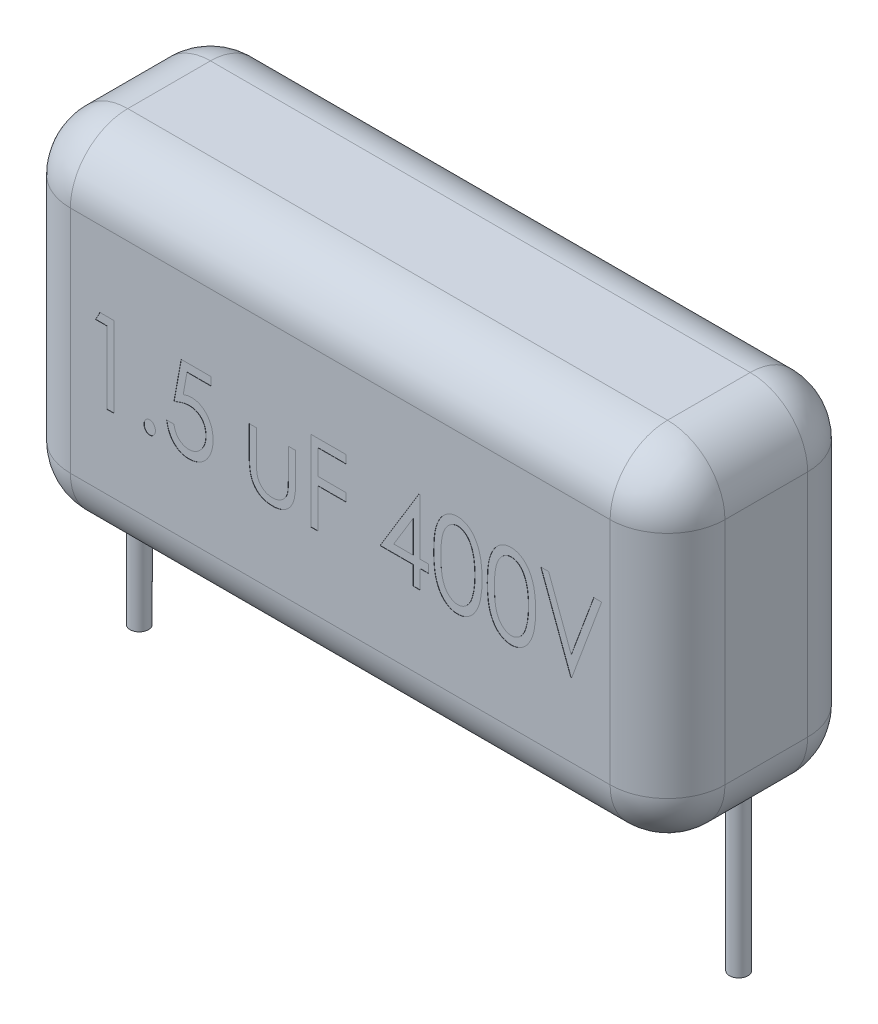
from build123d import *

# Parameters (mm, degrees)
BOSS_EXTRUDE1_DEPTH = 14.25
FILLET1_R           = 2.5
SKETCH2_R           = 0.4
BOSS_EXTRUDE2_DEPTH = 13.5
CUT_EXTRUDE1_DEPTH  = 0.01


with BuildPart() as part:
    # Sketch1 → Boss-Extrude1 (new, symmetric)
    with BuildSketch(Plane(origin=(0, 0, 0), x_dir=(0, 0, -1), z_dir=(1, 0, 0))):
        with BuildLine():
            Line((-1.8, 7.5), (1.8, 7.5))
            ThreePointArc((1.8, 7.5), (3.567766953, 6.767766953), (4.3, 5))
            Line((4.3, 5), (4.3, -5))
            ThreePointArc((4.3, -5), (3.567766953, -6.767766953), (1.8, -7.5))
            Line((1.8, -7.5), (-1.8, -7.5))
            ThreePointArc((-1.8, -7.5), (-3.567766953, -6.767766953), (-4.3, -5))
            Line((-4.3, -5), (-4.3, 5))
            ThreePointArc((-4.3, 5), (-3.567766953, 6.767766953), (-1.8, 7.5))
        make_face()
    extrude(amount=BOSS_EXTRUDE1_DEPTH, both=True)

    # Fillet1
    fillet1_edges = [part.edges().sort_by_distance(p)[0] for p in [
        (-14.25, 7.5, 0),
        (-14.25, 6.767766953, -3.567766953),
        (-14.25, 0, -4.3),
        (-14.25, -6.767766953, -3.567766953),
        (14.25, 6.767766953, -3.567766953),
        (14.25, 7.5, 0),
        (14.25, 6.767766953, 3.567766953),
        (14.25, 0, 4.3),
        (14.25, -6.767766953, 3.567766953),
        (14.25, -7.5, 0),
        (14.25, -6.767766953, -3.567766953),
        (-14.25, -7.5, 0),
        (14.25, 0, -4.3),
        (-14.25, -6.767766953, 3.567766953),
        (-14.25, 0, 4.3),
        (-14.25, 6.767766953, 3.567766953),
    ]]
    fillet(fillet1_edges, radius=FILLET1_R)

    # Sketch2 → Boss-Extrude2 (add)
    with BuildSketch(Plane(origin=(0, 0, 0), x_dir=(1, 0, 0), z_dir=(0, 1, 0))):
        with Locations(Location((13.05, 0, 0), (0, 0, 270))):
            Circle(SKETCH2_R)
        with Locations(Location((-13.05, 0, 0), (0, 0, 270))):
            Circle(SKETCH2_R)
    extrude(amount=-BOSS_EXTRUDE2_DEPTH)

    # Sketch4 → Cut-Extrude1 (cut)
    # profile 1 of 9: a face of its own
    with BuildSketch(Plane.XY.offset(4.3)):
        Polygon((-10.463761016, 1.706828106), (-9.843969349, 1.706828106), (-9.843969349, -1.793171894), (-10.158071914, -1.793171894), (-10.158071914, 1.347853747), (-10.651661657, 1.347853747), align=None)
    # profile 2 of 9: a face of its own
    with BuildSketch(Plane.XY.offset(4.3)):
        with BuildLine():
            add(Edge.make_bspline(
                [(-8.295892426, -1.254710355), (-8.279414886, -1.25586551), (-8.24688861, -1.258145757), (-8.199836892, -1.274207999), (-8.157153465, -1.301646569), (-8.119757992, -1.339021142), (-8.088370196, -1.383295335), (-8.065769069, -1.433548887), (-8.050915743, -1.488271279), (-8.049715004, -1.526644552), (-8.049097555, -1.546377022)],
                knots=[0, 0, 0, 0, 0.932051743, 1.839848197, 2.779380411, 3.780329255, 4.815317283, 5.833513928, 6.885940208, 8, 8, 8, 8], degree=3))
            add(Edge.make_bspline(
                [(-8.049097555, -1.546377022), (-8.049753958, -1.565635951), (-8.051045496, -1.603529748), (-8.065735246, -1.657825164), (-8.088574978, -1.708149084), (-8.119520701, -1.752950226), (-8.157155936, -1.790456979), (-8.19997759, -1.817654081), (-8.246739805, -1.834813569), (-8.279390612, -1.836959253), (-8.295892426, -1.838043688)],
                knots=[0, 0, 0, 0, 1.089197406, 2.143100788, 3.162726492, 4.210031689, 5.212385385, 6.153236251, 7.066640104, 8, 8, 8, 8], degree=3))
            add(Edge.make_bspline(
                [(-8.295892426, -1.838043688), (-8.312394241, -1.836959253), (-8.345045047, -1.834813569), (-8.391807262, -1.817654081), (-8.434628917, -1.790456979), (-8.472264152, -1.752950226), (-8.503209874, -1.708149084), (-8.526049606, -1.657825164), (-8.540739356, -1.603529748), (-8.542030894, -1.565635951), (-8.542687298, -1.546377022)],
                knots=[0, 0, 0, 0, 0.933359896, 1.846763749, 2.787614615, 3.789968311, 4.837273508, 5.856899212, 6.910802594, 8, 8, 8, 8], degree=3))
            add(Edge.make_bspline(
                [(-8.542687298, -1.546377022), (-8.542069849, -1.526644552), (-8.54086911, -1.488271279), (-8.526015784, -1.433548887), (-8.503414656, -1.383295335), (-8.47202686, -1.339021142), (-8.434631387, -1.301646569), (-8.39194796, -1.274207999), (-8.344896243, -1.258145757), (-8.312369967, -1.25586551), (-8.295892426, -1.254710355)],
                knots=[0, 0, 0, 0, 1.114059792, 2.166486072, 3.184682717, 4.219670745, 5.220619589, 6.160151803, 7.067948257, 8, 8, 8, 8], degree=3))
        make_face()
    # profile 3 of 9: a face of its own
    with BuildSketch(Plane.XY.offset(4.3)):
        with BuildLine():
            Line((-5.626020631, 1.706828106), (-5.626020631, 1.347853747))
            Line((-5.626020631, 1.347853747), (-6.671393228, 1.347853747))
            Line((-6.671393228, 1.347853747), (-6.837559093, 0.421671856))
            add(Edge.make_bspline(
                [(-6.837559093, 0.421671856), (-6.805698068, 0.432920113), (-6.744267404, 0.454607671), (-6.652866811, 0.477952108), (-6.566182359, 0.491838457), (-6.509946019, 0.494165835), (-6.482791465, 0.495289645)],
                knots=[0, 0, 0, 0, 1.113143318, 2.146231409, 3.104880253, 4, 4, 4, 4], degree=3))
            add(Edge.make_bspline(
                [(-6.482791465, 0.495289645), (-6.449074497, 0.494449051), (-6.382906933, 0.492799434), (-6.286269095, 0.476792947), (-6.194162306, 0.45135743), (-6.106420632, 0.416564981), (-6.023273009, 0.370836764), (-5.944756019, 0.315321836), (-5.870503304, 0.249656122), (-5.802567784, 0.173719831), (-5.739695374, 0.09138154), (-5.685300802, 0.001930053), (-5.639184203, -0.092682989), (-5.60070143, -0.192927334), (-5.5725641, -0.299318749), (-5.551393829, -0.411043647), (-5.538581471, -0.528518026), (-5.537055763, -0.60871152), (-5.536277042, -0.649642246)],
                knots=[0, 0, 0, 0, 0.973560614, 1.910555428, 2.821466426, 3.73059852, 4.631163213, 5.556699778, 6.503883695, 7.488691105, 8.49622651, 9.493389215, 10.5081404, 11.534042417, 12.590644417, 13.683294485, 14.817554483, 16, 16, 16, 16], degree=3))
            add(Edge.make_bspline(
                [(-5.536277042, -0.649642246), (-5.538103595, -0.706293395), (-5.541700802, -0.817861902), (-5.567916174, -0.981528926), (-5.612520546, -1.137894108), (-5.664031828, -1.261597685), (-5.712535577, -1.355557954), (-5.752682251, -1.421391206), (-5.795363036, -1.483512867), (-5.841787605, -1.540933206), (-5.890921889, -1.594381099), (-5.942982282, -1.643793068), (-5.998512139, -1.688855365), (-6.05743375, -1.729081923), (-6.118252665, -1.766207314), (-6.18253439, -1.796579146), (-6.248381162, -1.823551392), (-6.316831177, -1.845344831), (-6.387624145, -1.862175267), (-6.460776804, -1.87372237), (-6.536114823, -1.882159619), (-6.587234027, -1.882660871), (-6.613200119, -1.882915483)],
                knots=[0, 0, 0, 0, 1.854240742, 3.651732996, 5.409993055, 7.166221002, 8.028594238, 8.869695635, 9.688937347, 10.494306344, 11.284856283, 12.064219686, 12.842117024, 13.623131146, 14.398616627, 15.171985563, 15.947735206, 16.72687324, 17.521153864, 18.327430933, 19.15041553, 20, 20, 20, 20], degree=3))
            add(Edge.make_bspline(
                [(-6.613200119, -1.882915483), (-6.643873949, -1.882219632), (-6.704353154, -1.880847629), (-6.792986263, -1.866603644), (-6.878523073, -1.846138369), (-6.959991438, -1.815630342), (-7.037975631, -1.776907457), (-7.111475938, -1.728658534), (-7.182308201, -1.673058757), (-7.248395382, -1.608770374), (-7.309029035, -1.537361953), (-7.3639322, -1.460685833), (-7.412606071, -1.378892016), (-7.454529172, -1.292077962), (-7.489810829, -1.200107853), (-7.518310293, -1.103234532), (-7.541055997, -1.001349278), (-7.550635164, -0.931345105), (-7.555507811, -0.895735996)],
                knots=[0, 0, 0, 0, 0.980012484, 1.932278219, 2.86391096, 3.788442921, 4.707522156, 5.642386417, 6.594769441, 7.583067065, 8.584946701, 9.586603339, 10.595260768, 11.624716315, 12.665609409, 13.74146141, 14.851146399, 16, 16, 16, 16], degree=3))
            Line((-7.555507811, -0.895735996), (-7.241405247, -0.895735996))
            add(Edge.make_bspline(
                [(-7.241405247, -0.895735996), (-7.235053315, -0.929082926), (-7.222886944, -0.992955004), (-7.194849089, -1.082609169), (-7.162689236, -1.163378368), (-7.122110301, -1.234272346), (-7.075137093, -1.297074639), (-7.021172151, -1.352779483), (-6.960867608, -1.40298274), (-6.893458638, -1.445269299), (-6.822267752, -1.480501745), (-6.747586778, -1.504831034), (-6.671650324, -1.521351338), (-6.620063682, -1.52307785), (-6.59426983, -1.523941124)],
                knots=[0, 0, 0, 0, 1.237908536, 2.371066588, 3.422813746, 4.404583581, 5.342816831, 6.277826636, 7.229035638, 8.199176782, 9.175745742, 10.119776575, 11.059868941, 12, 12, 12, 12], degree=3))
            add(Edge.make_bspline(
                [(-6.59426983, -1.523941124), (-6.569209693, -1.523119657), (-6.519738232, -1.521497991), (-6.446915263, -1.508957345), (-6.376496445, -1.489915313), (-6.309590641, -1.460781905), (-6.244227653, -1.426411916), (-6.183566402, -1.380984873), (-6.123969344, -1.329949638), (-6.068729184, -1.270597091), (-6.017680338, -1.205735174), (-5.972528112, -1.136190146), (-5.934717521, -1.062341686), (-5.903598828, -0.984694409), (-5.879805749, -0.903185323), (-5.863237061, -0.817735346), (-5.852238347, -0.728453039), (-5.85100738, -0.667437753), (-5.850379606, -0.636320932)],
                knots=[0, 0, 0, 0, 0.933673813, 1.843174603, 2.747905908, 3.645942738, 4.55819341, 5.494019063, 6.463585747, 7.480531844, 8.510567353, 9.537614091, 10.566285436, 11.598455736, 12.651591861, 13.726309059, 14.840453956, 16, 16, 16, 16], degree=3))
            add(Edge.make_bspline(
                [(-5.850379606, -0.636320932), (-5.850756201, -0.608240269), (-5.851493049, -0.553297486), (-5.861994823, -0.47318132), (-5.876975466, -0.397060004), (-5.898892152, -0.324975832), (-5.927053451, -0.257016571), (-5.960559881, -0.192429597), (-6.00165639, -0.132926167), (-6.047932529, -0.077584357), (-6.098731347, -0.026809563), (-6.155033911, 0.016620897), (-6.215469853, 0.053194569), (-6.279304794, 0.084868881), (-6.348458869, 0.107267314), (-6.421085454, 0.124495168), (-6.497955224, 0.134205521), (-6.550540884, 0.135601251), (-6.577442907, 0.136315286)],
                knots=[0, 0, 0, 0, 1.127360635, 2.20580017, 3.240687026, 4.241666562, 5.226843905, 6.192863443, 7.15906549, 8.125632452, 9.088360914, 10.038692719, 10.974299228, 11.923377817, 12.894313054, 13.887334147, 14.919192329, 16, 16, 16, 16], degree=3))
            add(Edge.make_bspline(
                [(-6.577442907, 0.136315286), (-6.600835506, 0.135733862), (-6.649162708, 0.134532689), (-6.723191231, 0.12571006), (-6.800876602, 0.111459639), (-6.882083166, 0.091742928), (-6.966999203, 0.06638196), (-7.055535582, 0.035181149), (-7.147855237, -0.000912507), (-7.209740915, -0.028868151), (-7.241405247, -0.043171894)],
                knots=[0, 0, 0, 0, 0.810269167, 1.673950008, 2.579134618, 3.545268136, 4.567349434, 5.647883586, 6.7965197, 8, 8, 8, 8], degree=3))
            Line((-7.241405247, -0.043171894), (-6.927302683, 1.706828106))
            Line((-6.927302683, 1.706828106), (-5.626020631, 1.706828106))
        make_face()
    # profile 4 of 9: a face of its own
    with BuildSketch(Plane.XY.offset(4.3)):
        with BuildLine():
            Line((-3.965764221, 0.764520414), (-3.651661657, 0.764520414))
            Line((-3.651661657, 0.764520414), (-3.651661657, -0.421777663))
            add(Edge.make_bspline(
                [(-3.651661657, -0.421777663), (-3.651570938, -0.456602396), (-3.651397397, -0.523220478), (-3.648889213, -0.619031113), (-3.646784985, -0.706499898), (-3.641447598, -0.7854645), (-3.636167612, -0.85610956), (-3.629282739, -0.918094243), (-3.621178969, -0.971982047), (-3.613742693, -1.004677825), (-3.610295471, -1.019834554)],
                knots=[0, 0, 0, 0, 1.391532709, 2.661936892, 3.829901352, 4.887223925, 5.824101155, 6.660496541, 7.379048576, 8, 8, 8, 8], degree=3))
            add(Edge.make_bspline(
                [(-3.610295471, -1.019834554), (-3.598658506, -1.057243052), (-3.5759741, -1.130164942), (-3.521995395, -1.229712293), (-3.45489031, -1.317218351), (-3.373718885, -1.391309611), (-3.280902861, -1.449947177), (-3.179160934, -1.493778374), (-3.068179496, -1.519378684), (-2.99133721, -1.522394825), (-2.951942106, -1.523941124)],
                knots=[0, 0, 0, 0, 1.047486636, 2.041907865, 3.014989621, 3.990003216, 4.969629675, 5.943033671, 6.945445186, 8, 8, 8, 8], degree=3))
            add(Edge.make_bspline(
                [(-2.951942106, -1.523941124), (-2.912783236, -1.522359898), (-2.836688159, -1.519287197), (-2.727217178, -1.494451123), (-2.62725941, -1.452340834), (-2.537502024, -1.394550608), (-2.45840189, -1.323630578), (-2.393134313, -1.240360987), (-2.338785334, -1.147841781), (-2.315791972, -1.079705359), (-2.304105567, -1.045074938)],
                knots=[0, 0, 0, 0, 1.083224142, 2.104964324, 3.087867758, 4.071345921, 5.047068855, 6.014022567, 6.990624521, 8, 8, 8, 8], degree=3))
            add(Edge.make_bspline(
                [(-2.304105567, -1.045074938), (-2.300337273, -1.031108012), (-2.29200128, -1.000211229), (-2.284585453, -0.94771341), (-2.276629236, -0.885366479), (-2.270379368, -0.812394412), (-2.266766836, -0.729119981), (-2.262982788, -0.635647896), (-2.261019507, -0.532095726), (-2.26076763, -0.459638853), (-2.260636016, -0.421777663)],
                knots=[0, 0, 0, 0, 0.553958893, 1.225434092, 2.028671365, 2.963679295, 4.030914419, 5.223034872, 6.548940879, 8, 8, 8, 8], degree=3))
            Line((-2.260636016, -0.421777663), (-2.260636016, 0.764520414))
            Line((-2.260636016, 0.764520414), (-1.946533452, 0.764520414))
            Line((-1.946533452, 0.764520414), (-1.946533452, -0.480671894))
            add(Edge.make_bspline(
                [(-1.946533452, -0.480671894), (-1.946636183, -0.52298287), (-1.946835502, -0.605074988), (-1.953113642, -0.724275163), (-1.960597461, -0.835476253), (-1.973823635, -0.93851457), (-1.988630073, -1.033388769), (-2.007344287, -1.120394818), (-2.03067294, -1.198922367), (-2.064407342, -1.29221881), (-2.116839801, -1.397380714), (-2.194313795, -1.509764824), (-2.286000041, -1.608065489), (-2.373720321, -1.677218558), (-2.450664549, -1.72412803), (-2.511967211, -1.75499103), (-2.577194752, -1.780108482), (-2.645575202, -1.801268524), (-2.717708039, -1.818106569), (-2.793408517, -1.829814385), (-2.872571524, -1.837081734), (-2.926451696, -1.837717891), (-2.954045471, -1.838043688)],
                knots=[0, 0, 0, 0, 1.312098829, 2.54574533, 3.701569955, 4.767896179, 5.766537578, 6.679358675, 7.525722669, 8.305423759, 9.754479426, 11.155959474, 12.525277459, 13.908701379, 14.604880684, 15.31806066, 16.034181596, 16.770167898, 17.536786682, 18.329287869, 19.144374379, 20, 20, 20, 20], degree=3))
            add(Edge.make_bspline(
                [(-2.954045471, -1.838043688), (-2.981637916, -1.837704794), (-3.035748331, -1.837040201), (-3.114930795, -1.82992945), (-3.190606076, -1.818031185), (-3.262721913, -1.801175847), (-3.331575284, -1.780085267), (-3.397373078, -1.755179646), (-3.458941293, -1.723921774), (-3.536576313, -1.677428602), (-3.624997837, -1.607980855), (-3.717576407, -1.509196139), (-3.794559789, -1.394985708), (-3.847947004, -1.289069291), (-3.881697212, -1.194492606), (-3.90514878, -1.114347062), (-3.923449254, -1.025390479), (-3.938686165, -0.928023409), (-3.95156215, -0.822599442), (-3.959258543, -0.708387503), (-3.96545458, -0.585907673), (-3.965658785, -0.501247374), (-3.965764221, -0.457534874)],
                knots=[0, 0, 0, 0, 0.844445595, 1.656007694, 2.431087477, 3.187689243, 3.920896429, 4.634327057, 5.338188272, 6.031389025, 7.402366307, 8.763903704, 10.158861678, 11.604980077, 12.381214554, 13.230253831, 14.159118366, 15.158838041, 16.246741172, 17.408865503, 18.662124194, 20, 20, 20, 20], degree=3))
            Line((-3.965764221, -0.457534874), (-3.965764221, 0.764520414))
        make_face()
    # profile 5 of 9: a face of its own
    with BuildSketch(Plane.XY.offset(4.3)):
        Polygon((-1.273456529, 1.706828106), (0.252184497, 1.706828106), (0.252184497, 1.347853747), (-0.959353965, 1.347853747), (-0.959353965, 0.27093067), (0.252184497, 0.27093067), (0.252184497, -0.088043688), (-0.959353965, -0.088043688), (-0.959353965, -1.793171894), (-1.273456529, -1.793171894), align=None)
    # profile 6 of 9: a face of its own
    with BuildSketch(Plane.XY.offset(4.3)):
        Polygon((3.419151644, 1.796571696), (3.482953727, 1.796571696), (3.482953727, -0.626505227), (3.841928086, -0.626505227), (3.841928086, -0.985479586), (3.482953727, -0.985479586), (3.482953727, -1.793171894), (3.168851163, -1.793171894), (3.168851163, -0.985479586), (1.732953727, -0.985479586), align=None)
        Polygon((3.168851163, -0.626505227), (3.168851163, 0.755405831), (2.33171174, -0.626505227), align=None, mode=Mode.SUBTRACT)
    # profile 7 of 9: a face of its own
    with BuildSketch(Plane.XY.offset(4.3)):
        with BuildLine():
            add(Edge.make_bspline(
                [(4.066287061, -0.044574137), (4.066636894, 0.011523982), (4.067316388, 0.120485571), (4.074103369, 0.279199571), (4.083062596, 0.42824415), (4.098241454, 0.567305544), (4.115976648, 0.696513656), (4.138336871, 0.81586775), (4.164649774, 0.92551949), (4.19587949, 1.025787191), (4.230317755, 1.118575452), (4.268856463, 1.204586519), (4.310650438, 1.284884645), (4.354129604, 1.36038334), (4.403083713, 1.428884522), (4.453894944, 1.492547581), (4.509294852, 1.549486799), (4.567020588, 1.60155508), (4.62830616, 1.646757736), (4.69069755, 1.687285034), (4.755330354, 1.720907393), (4.821775117, 1.748398784), (4.889719981, 1.770283664), (4.959651887, 1.785731118), (5.031238434, 1.795124392), (5.079613463, 1.796087319), (5.103947317, 1.796571696)],
                knots=[0, 0, 0, 0, 1.712737898, 3.326718361, 4.849934128, 6.270757035, 7.596796976, 8.831195979, 9.976938934, 11.037759367, 12.035809522, 12.997271036, 13.913248545, 14.799301666, 15.654562441, 16.48149021, 17.283916513, 18.077408965, 18.852363637, 19.606538973, 20.347018853, 21.073229694, 21.799896157, 22.523578351, 23.257322845, 24, 24, 24, 24], degree=3))
            add(Edge.make_bspline(
                [(5.103947317, 1.796571696), (5.128750215, 1.796101814), (5.177827968, 1.795172053), (5.250550972, 1.785633641), (5.321477131, 1.770431361), (5.390473916, 1.748216921), (5.45803599, 1.7211486), (5.523545868, 1.687010114), (5.587486818, 1.647139107), (5.648997851, 1.600471785), (5.709141526, 1.548871739), (5.764936266, 1.489690737), (5.817426109, 1.424535047), (5.868695911, 1.35471635), (5.91416289, 1.277011924), (5.958152076, 1.19427611), (5.997714296, 1.104767424), (6.03530242, 1.009374999), (6.068243098, 0.90632509), (6.096857101, 0.795344603), (6.121213437, 0.675975309), (6.14155275, 0.54828153), (6.156943012, 0.411886246), (6.166722842, 0.267062182), (6.174407417, 0.113960278), (6.174971804, 0.009189268), (6.17526142, -0.044574137)],
                knots=[0, 0, 0, 0, 0.752180744, 1.488347903, 2.221332102, 2.950188717, 3.684954335, 4.427073921, 5.188489928, 5.968499684, 6.767646011, 7.590201753, 8.43188258, 9.305659254, 10.215299127, 11.160505459, 12.147606989, 13.182625504, 14.270232933, 15.427717507, 16.658470434, 17.96531266, 19.349783444, 20.821468742, 22.368931779, 24, 24, 24, 24], degree=3))
            add(Edge.make_bspline(
                [(6.17526142, -0.044574137), (6.174862661, -0.098098514), (6.174085746, -0.202381744), (6.167911311, -0.354864226), (6.156715832, -0.498904863), (6.141411155, -0.634562338), (6.121971933, -0.761619624), (6.09804718, -0.880447164), (6.07070883, -0.991204042), (6.037132658, -1.093431689), (6.000747155, -1.188497268), (5.960701097, -1.277228704), (5.917095418, -1.359931973), (5.871127637, -1.437358621), (5.821266421, -1.50842793), (5.767698932, -1.573258363), (5.711014358, -1.632128206), (5.651355222, -1.685091626), (5.588676173, -1.730951252), (5.525106643, -1.772391666), (5.458659991, -1.805648751), (5.391185865, -1.834227197), (5.321648752, -1.855943987), (5.250503758, -1.871076423), (5.177885922, -1.881743982), (5.128759466, -1.882522354), (5.103947317, -1.882915483)],
                knots=[0, 0, 0, 0, 1.625791635, 3.16758111, 4.634362493, 6.013326105, 7.313513755, 8.537269154, 9.694283847, 10.776350794, 11.803341178, 12.785072982, 13.731335007, 14.641990848, 15.518412538, 16.365536825, 17.193923029, 17.998641004, 18.785212613, 19.551271023, 20.300534794, 21.03882223, 21.775264372, 22.509067235, 23.246979152, 24, 24, 24, 24], degree=3))
            add(Edge.make_bspline(
                [(5.103947317, -1.882915483), (5.079613891, -1.882429185), (5.031239711, -1.881462436), (4.959646877, -1.872097424), (4.890025139, -1.856607886), (4.822346574, -1.835270834), (4.755982323, -1.809023041), (4.692217254, -1.774657895), (4.629764885, -1.735507107), (4.569158358, -1.69065644), (4.511836976, -1.639132937), (4.45675267, -1.58235837), (4.405579834, -1.518709806), (4.35750166, -1.449495676), (4.312239995, -1.374712506), (4.270889541, -1.293836775), (4.233402178, -1.206710088), (4.197925026, -1.113579869), (4.165854845, -1.012680189), (4.140002804, -0.902108315), (4.116481355, -0.782474814), (4.099008715, -0.65316601), (4.083965477, -0.51456275), (4.073839269, -0.366277939), (4.067397965, -0.208460748), (4.066664142, -0.100203237), (4.066287061, -0.044574137)],
                knots=[0, 0, 0, 0, 0.743613562, 1.478283201, 2.202877853, 2.921494687, 3.645913188, 4.380999621, 5.13229658, 5.898229586, 6.68263495, 7.486072995, 8.314043399, 9.176234408, 10.060926981, 10.984410639, 11.950736434, 12.959248835, 14.030356592, 15.184487265, 16.428798955, 17.756510839, 19.172020399, 20.690514867, 22.299391159, 24, 24, 24, 24], degree=3))
        make_face()
        with BuildLine():
            add(Edge.make_bspline(
                [(4.380389625, -0.043171894), (4.380640014, -0.089916888), (4.381125877, -0.180622352), (4.385397411, -0.31246952), (4.392163543, -0.435460227), (4.402037629, -0.549552587), (4.414168265, -0.654901233), (4.43058819, -0.751381789), (4.448271493, -0.839292914), (4.469706851, -0.918780737), (4.493357365, -0.991772458), (4.521229651, -1.059041682), (4.550147549, -1.122408278), (4.582848266, -1.18061859), (4.616959709, -1.235255776), (4.654858276, -1.284684567), (4.695015348, -1.330086219), (4.751043048, -1.383133667), (4.82448328, -1.43891101), (4.918354984, -1.487472023), (5.015128194, -1.518046517), (5.08106749, -1.521987176), (5.113763022, -1.523941124)],
                knots=[0, 0, 0, 0, 1.533539051, 2.975727605, 4.327350958, 5.574085108, 6.732432991, 7.805117054, 8.784043935, 9.673055441, 10.504702577, 11.299185573, 12.060685142, 12.788272239, 13.488058854, 14.171998547, 14.82910999, 15.474486357, 16.70125626, 17.839742354, 18.928851556, 20, 20, 20, 20], degree=3))
            add(Edge.make_bspline(
                [(5.113763022, -1.523941124), (5.146720594, -1.522351349), (5.212749738, -1.5191663), (5.308794261, -1.4877992), (5.402167364, -1.441607149), (5.474001135, -1.386204533), (5.52899287, -1.334291809), (5.568676867, -1.289515469), (5.605627229, -1.240110409), (5.639120775, -1.185532206), (5.671029045, -1.126935068), (5.700315681, -1.063560607), (5.726213451, -0.994974456), (5.741259031, -0.947460552), (5.748979369, -0.923079746)],
                knots=[0, 0, 0, 0, 1.260031109, 2.524420714, 3.838978787, 5.240585022, 5.982240997, 6.737630522, 7.53163645, 8.34478141, 9.190888301, 10.089069349, 11.019444295, 12, 12, 12, 12], degree=3))
            add(Edge.make_bspline(
                [(5.748979369, -0.923079746), (5.758232323, -0.891859933), (5.777025666, -0.828450498), (5.798719652, -0.729664632), (5.818893192, -0.626941304), (5.833645461, -0.519185161), (5.846873045, -0.407054007), (5.854505247, -0.289807759), (5.860804649, -0.168039585), (5.861039499, -0.08524849), (5.861158856, -0.043171894)],
                knots=[0, 0, 0, 0, 0.877554436, 1.782369142, 2.725190345, 3.699077286, 4.713512245, 5.768404222, 6.865844737, 8, 8, 8, 8], degree=3))
            add(Edge.make_bspline(
                [(5.861158856, -0.043171894), (5.860972436, -0.00109837), (5.860607746, 0.081209539), (5.855351039, 0.201597194), (5.848044337, 0.316210687), (5.836642274, 0.424909673), (5.822793973, 0.527821873), (5.806116292, 0.624961559), (5.785979365, 0.716285267), (5.761782086, 0.801685906), (5.736401944, 0.881752152), (5.707199957, 0.955705644), (5.676594691, 1.024392808), (5.64380541, 1.087898854), (5.607906622, 1.145374656), (5.570133426, 1.197756332), (5.529376502, 1.244103325), (5.473253722, 1.29733128), (5.3998199, 1.352259871), (5.307627273, 1.40204757), (5.21134902, 1.431536269), (5.14620325, 1.435582474), (5.113763022, 1.437597337)],
                knots=[0, 0, 0, 0, 1.381209292, 2.702042534, 3.955571768, 5.151192574, 6.289502008, 7.36425752, 8.386253595, 9.358021076, 10.277650789, 11.142548216, 11.966806051, 12.745861644, 13.486804304, 14.189703291, 14.86387237, 15.509720055, 16.726644761, 17.862702138, 18.935703305, 20, 20, 20, 20], degree=3))
            add(Edge.make_bspline(
                [(5.113763022, 1.437597337), (5.080858804, 1.435579285), (5.014801981, 1.431527948), (4.917332027, 1.402186081), (4.824252719, 1.35253027), (4.751120382, 1.297183867), (4.694833548, 1.245111714), (4.654823773, 1.199935944), (4.617747089, 1.150077503), (4.583488062, 1.095716329), (4.55092911, 1.037431288), (4.521693109, 0.974285993), (4.49517132, 0.906509204), (4.470049447, 0.834034047), (4.449316868, 0.75421728), (4.430175167, 0.666848546), (4.415045136, 0.570114565), (4.402882056, 0.464584402), (4.391978409, 0.350320977), (4.385422777, 0.227057167), (4.381115302, 0.094980614), (4.380636393, 0.00380716), (4.380389625, -0.043171894)],
                knots=[0, 0, 0, 0, 1.078543429, 2.165228563, 3.306998572, 4.522771429, 5.16274981, 5.819718716, 6.498896924, 7.198531744, 7.925961016, 8.687295404, 9.478752755, 10.312654144, 11.20147281, 12.181777119, 13.24542559, 14.411133613, 15.665913912, 17.009590841, 18.45912833, 20, 20, 20, 20], degree=3))
        make_face(mode=Mode.SUBTRACT)
    # profile 8 of 9: a face of its own
    with BuildSketch(Plane.XY.offset(4.3)):
        with BuildLine():
            add(Edge.make_bspline(
                [(6.399620394, -0.044574137), (6.399970227, 0.011523982), (6.400649721, 0.120485571), (6.407436703, 0.279199571), (6.416395929, 0.42824415), (6.431574787, 0.567305544), (6.449309981, 0.696513656), (6.471670204, 0.81586775), (6.497983107, 0.92551949), (6.529212823, 1.025787191), (6.563651089, 1.118575452), (6.602189797, 1.204586519), (6.643983771, 1.284884645), (6.687462937, 1.36038334), (6.736417046, 1.428884522), (6.787228278, 1.492547581), (6.842628185, 1.549486799), (6.900353921, 1.60155508), (6.961639493, 1.646757736), (7.024030883, 1.687285034), (7.088663687, 1.720907393), (7.155108451, 1.748398784), (7.223053314, 1.770283664), (7.292985221, 1.785731118), (7.364571767, 1.795124392), (7.412946796, 1.796087319), (7.437280651, 1.796571696)],
                knots=[0, 0, 0, 0, 1.712737898, 3.326718361, 4.849934128, 6.270757035, 7.596796976, 8.831195979, 9.976938934, 11.037759367, 12.035809522, 12.997271036, 13.913248545, 14.799301666, 15.654562441, 16.48149021, 17.283916513, 18.077408965, 18.852363637, 19.606538973, 20.347018853, 21.073229694, 21.799896157, 22.523578351, 23.257322845, 24, 24, 24, 24], degree=3))
            add(Edge.make_bspline(
                [(7.437280651, 1.796571696), (7.462083548, 1.796101814), (7.511161301, 1.795172053), (7.583884306, 1.785633641), (7.654810464, 1.770431361), (7.723807249, 1.748216921), (7.791369323, 1.7211486), (7.856879201, 1.687010114), (7.920820151, 1.647139107), (7.982331184, 1.600471785), (8.042474859, 1.548871739), (8.0982696, 1.489690737), (8.150759442, 1.424535047), (8.202029244, 1.35471635), (8.247496223, 1.277011924), (8.291485409, 1.19427611), (8.331047629, 1.104767424), (8.368635753, 1.009374999), (8.401576431, 0.90632509), (8.430190435, 0.795344603), (8.45454677, 0.675975309), (8.474886083, 0.54828153), (8.490276345, 0.411886246), (8.500056175, 0.267062182), (8.507740751, 0.113960278), (8.508305137, 0.009189268), (8.508594753, -0.044574137)],
                knots=[0, 0, 0, 0, 0.752180744, 1.488347903, 2.221332102, 2.950188717, 3.684954335, 4.427073921, 5.188489928, 5.968499684, 6.767646011, 7.590201753, 8.43188258, 9.305659254, 10.215299127, 11.160505459, 12.147606989, 13.182625504, 14.270232933, 15.427717507, 16.658470434, 17.96531266, 19.349783444, 20.821468742, 22.368931779, 24, 24, 24, 24], degree=3))
            add(Edge.make_bspline(
                [(8.508594753, -0.044574137), (8.508195994, -0.098098514), (8.50741908, -0.202381744), (8.501244644, -0.354864226), (8.490049165, -0.498904863), (8.474744489, -0.634562338), (8.455305267, -0.761619624), (8.431380513, -0.880447164), (8.404042164, -0.991204042), (8.370465991, -1.093431689), (8.334080488, -1.188497268), (8.29403443, -1.277228704), (8.250428751, -1.359931973), (8.20446097, -1.437358621), (8.154599754, -1.50842793), (8.101032266, -1.573258363), (8.044347691, -1.632128206), (7.984688555, -1.685091626), (7.922009507, -1.730951252), (7.858439976, -1.772391666), (7.791993324, -1.805648751), (7.724519198, -1.834227197), (7.654982085, -1.855943987), (7.583837091, -1.871076423), (7.511219256, -1.881743982), (7.462092799, -1.882522354), (7.437280651, -1.882915483)],
                knots=[0, 0, 0, 0, 1.625791635, 3.16758111, 4.634362493, 6.013326105, 7.313513755, 8.537269154, 9.694283847, 10.776350794, 11.803341178, 12.785072982, 13.731335007, 14.641990848, 15.518412538, 16.365536825, 17.193923029, 17.998641004, 18.785212613, 19.551271023, 20.300534794, 21.03882223, 21.775264372, 22.509067235, 23.246979152, 24, 24, 24, 24], degree=3))
            add(Edge.make_bspline(
                [(7.437280651, -1.882915483), (7.412947224, -1.882429185), (7.364573045, -1.881462436), (7.29298021, -1.872097424), (7.223358473, -1.856607886), (7.155679907, -1.835270834), (7.089315656, -1.809023041), (7.025550587, -1.774657895), (6.963098218, -1.735507107), (6.902491692, -1.69065644), (6.84517031, -1.639132937), (6.790086004, -1.58235837), (6.738913167, -1.518709806), (6.690834993, -1.449495676), (6.645573329, -1.374712506), (6.604222875, -1.293836775), (6.566735511, -1.206710088), (6.531258359, -1.113579869), (6.499188178, -1.012680189), (6.473336137, -0.902108315), (6.449814689, -0.782474814), (6.432342048, -0.65316601), (6.41729881, -0.51456275), (6.407172603, -0.366277939), (6.400731298, -0.208460748), (6.399997475, -0.100203237), (6.399620394, -0.044574137)],
                knots=[0, 0, 0, 0, 0.743613562, 1.478283201, 2.202877853, 2.921494687, 3.645913188, 4.380999621, 5.13229658, 5.898229586, 6.68263495, 7.486072995, 8.314043399, 9.176234408, 10.060926981, 10.984410639, 11.950736434, 12.959248835, 14.030356592, 15.184487265, 16.428798955, 17.756510839, 19.172020399, 20.690514867, 22.299391159, 24, 24, 24, 24], degree=3))
        make_face()
        with BuildLine():
            add(Edge.make_bspline(
                [(6.713722958, -0.043171894), (6.713973347, -0.089916888), (6.71445921, -0.180622352), (6.718730745, -0.31246952), (6.725496876, -0.435460227), (6.735370962, -0.549552587), (6.747501598, -0.654901233), (6.763921524, -0.751381789), (6.781604826, -0.839292914), (6.803040185, -0.918780737), (6.826690698, -0.991772458), (6.854562984, -1.059041682), (6.883480882, -1.122408278), (6.916181599, -1.18061859), (6.950293042, -1.235255776), (6.988191609, -1.284684567), (7.028348682, -1.330086219), (7.084376382, -1.383133667), (7.157816613, -1.43891101), (7.251688318, -1.487472023), (7.348461527, -1.518046517), (7.414400823, -1.521987176), (7.447096356, -1.523941124)],
                knots=[0, 0, 0, 0, 1.533539051, 2.975727605, 4.327350958, 5.574085108, 6.732432991, 7.805117054, 8.784043935, 9.673055441, 10.504702577, 11.299185573, 12.060685142, 12.788272239, 13.488058854, 14.171998547, 14.82910999, 15.474486357, 16.70125626, 17.839742354, 18.928851556, 20, 20, 20, 20], degree=3))
            add(Edge.make_bspline(
                [(7.447096356, -1.523941124), (7.480053927, -1.522351349), (7.546083071, -1.5191663), (7.642127594, -1.4877992), (7.735500697, -1.441607149), (7.807334469, -1.386204533), (7.862326203, -1.334291809), (7.9020102, -1.289515469), (7.938960563, -1.240110409), (7.972454109, -1.185532206), (8.004362378, -1.126935068), (8.033649014, -1.063560607), (8.059546784, -0.994974456), (8.074592364, -0.947460552), (8.082312702, -0.923079746)],
                knots=[0, 0, 0, 0, 1.260031109, 2.524420714, 3.838978787, 5.240585022, 5.982240997, 6.737630522, 7.53163645, 8.34478141, 9.190888301, 10.089069349, 11.019444295, 12, 12, 12, 12], degree=3))
            add(Edge.make_bspline(
                [(8.082312702, -0.923079746), (8.091565657, -0.891859933), (8.110359, -0.828450498), (8.132052986, -0.729664632), (8.152226525, -0.626941304), (8.166978794, -0.519185161), (8.180206379, -0.407054007), (8.18783858, -0.289807759), (8.194137982, -0.168039585), (8.194372832, -0.08524849), (8.194492189, -0.043171894)],
                knots=[0, 0, 0, 0, 0.877554436, 1.782369142, 2.725190345, 3.699077286, 4.713512245, 5.768404222, 6.865844737, 8, 8, 8, 8], degree=3))
            add(Edge.make_bspline(
                [(8.194492189, -0.043171894), (8.19430577, -0.00109837), (8.193941079, 0.081209539), (8.188684372, 0.201597194), (8.18137767, 0.316210687), (8.169975607, 0.424909673), (8.156127306, 0.527821873), (8.139449625, 0.624961559), (8.119312698, 0.716285267), (8.095115419, 0.801685906), (8.069735277, 0.881752152), (8.04053329, 0.955705644), (8.009928025, 1.024392808), (7.977138743, 1.087898854), (7.941239956, 1.145374656), (7.90346676, 1.197756332), (7.862709836, 1.244103325), (7.806587056, 1.29733128), (7.733153233, 1.352259871), (7.640960606, 1.40204757), (7.544682353, 1.431536269), (7.479536583, 1.435582474), (7.447096356, 1.437597337)],
                knots=[0, 0, 0, 0, 1.381209292, 2.702042534, 3.955571768, 5.151192574, 6.289502008, 7.36425752, 8.386253595, 9.358021076, 10.277650789, 11.142548216, 11.966806051, 12.745861644, 13.486804304, 14.189703291, 14.86387237, 15.509720055, 16.726644761, 17.862702138, 18.935703305, 20, 20, 20, 20], degree=3))
            add(Edge.make_bspline(
                [(7.447096356, 1.437597337), (7.414192138, 1.435579285), (7.348135315, 1.431527948), (7.25066536, 1.402186081), (7.157586052, 1.35253027), (7.084453715, 1.297183867), (7.028166881, 1.245111714), (6.988157106, 1.199935944), (6.951080422, 1.150077503), (6.916821396, 1.095716329), (6.884262443, 1.037431288), (6.855026442, 0.974285993), (6.828504654, 0.906509204), (6.80338278, 0.834034047), (6.782650201, 0.75421728), (6.7635085, 0.666848546), (6.748378469, 0.570114565), (6.736215389, 0.464584402), (6.725311742, 0.350320977), (6.71875611, 0.227057167), (6.714448636, 0.094980614), (6.713969726, 0.00380716), (6.713722958, -0.043171894)],
                knots=[0, 0, 0, 0, 1.078543429, 2.165228563, 3.306998572, 4.522771429, 5.16274981, 5.819718716, 6.498896924, 7.198531744, 7.925961016, 8.687295404, 9.478752755, 10.312654144, 11.20147281, 12.181777119, 13.24542559, 14.411133613, 15.665913912, 17.009590841, 18.45912833, 20, 20, 20, 20], degree=3))
        make_face(mode=Mode.SUBTRACT)
    # profile 9 of 9: a face of its own
    with BuildSketch(Plane.XY.offset(4.3)):
        Polygon((8.732953727, 1.706828106), (9.07369892, 1.706828106), (10.056671676, -0.937803304), (11.039644433, 1.706828106), (11.380389625, 1.706828106), (10.079107574, -1.793171894), (10.034235779, -1.793171894), align=None)
    extrude(amount=-CUT_EXTRUDE1_DEPTH, mode=Mode.SUBTRACT)


solid = part.part
